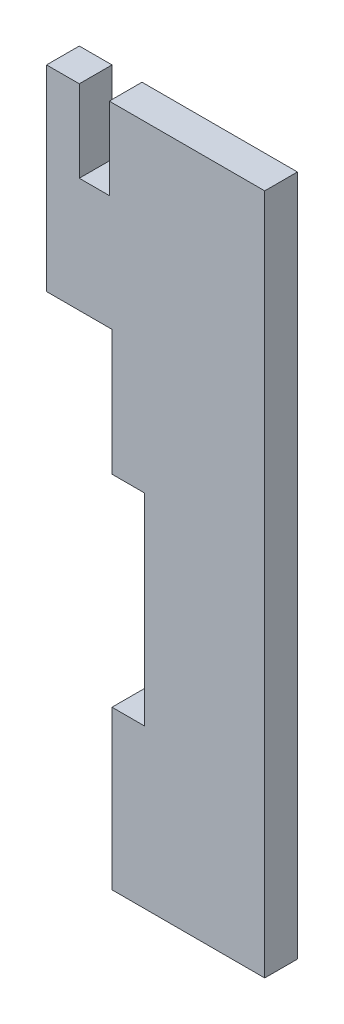
from build123d import *

# Parameters (mm, degrees)
SKETCH1_W           = 40
SKETCH1_H           = 125
BOSS_EXTRUDE1_DEPTH = 6
SKETCH2_W           = 5.5
SKETCH2_H           = 15
SKETCH2_W_2         = 12
SKETCH2_H_2         = 89
CUT_EXTRUDE1_DEPTH  = 132.381124976
SKETCH3_W           = 6
SKETCH3_H           = 37
CUT_EXTRUDE2_DEPTH  = 132.381124976


with BuildPart() as part:
    # Sketch1 → Boss-Extrude1 (new body)
    with BuildSketch(Plane.XY):
        with Locations((20, 62.5)):
            Rectangle(SKETCH1_W, SKETCH1_H)
    extrude(amount=BOSS_EXTRUDE1_DEPTH)

    # Sketch2 → Cut-Extrude1 (cut, through all)
    with BuildSketch(Plane.XY.offset(6)):
        with Locations((8.75, 117.5)):
            Rectangle(SKETCH2_W, SKETCH2_H)
        with Locations((6, 44.5)):
            Rectangle(SKETCH2_W_2, SKETCH2_H_2)
    extrude(amount=-CUT_EXTRUDE1_DEPTH, mode=Mode.SUBTRACT)

    # Sketch3 → Cut-Extrude2 (cut, through all)
    with BuildSketch(Plane.XY.offset(6)):
        with Locations((15, 47.5)):
            Rectangle(SKETCH3_W, SKETCH3_H)
    extrude(amount=-CUT_EXTRUDE2_DEPTH, mode=Mode.SUBTRACT)


solid = part.part
